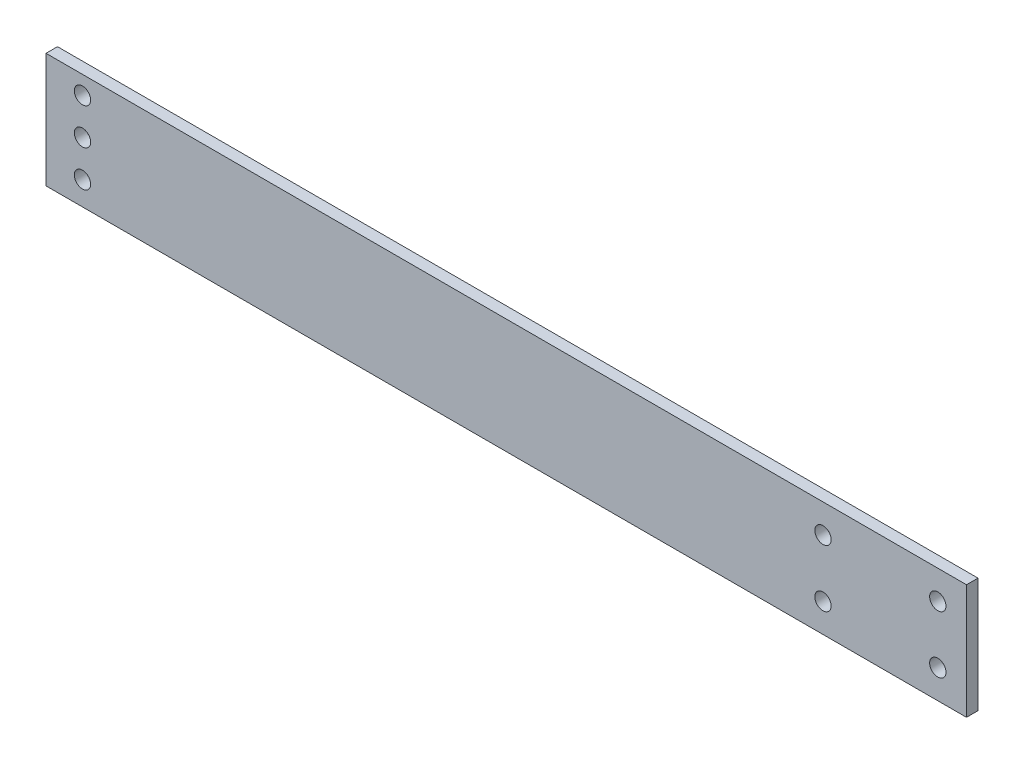
from build123d import *

# Parameters (mm, degrees)
SKETCH1_W           = 160.31
SKETCH1_H           = 20
BOSS_EXTRUDE1_DEPTH = 2
CUT_EXTRUDE1_REACH  = 82.801
SKETCH2_R           = 1.4224


with BuildPart() as part:
    # Sketch1 → Boss-Extrude1 (new body)
    with BuildSketch(Plane.XY):
        Rectangle(SKETCH1_W, SKETCH1_H)
    extrude(amount=BOSS_EXTRUDE1_DEPTH)

    # Sketch2 → Cut-Extrude1 (cut, up to next)
    with BuildSketch(Plane.XY.offset(2), mode=Mode.PRIVATE) as cut_extrude1_sk1:
        with Locations((-73.805, 6.825)):
            Circle(SKETCH2_R)
    cut_extrude1_tool1 = extrude(cut_extrude1_sk1.sketch, amount=-CUT_EXTRUDE1_REACH, mode=Mode.PRIVATE) & part.part
    # Sketch2 → Cut-Extrude1 (cut, up to next)
    with BuildSketch(Plane.XY.offset(2), mode=Mode.PRIVATE) as cut_extrude1_sk2:
        with Locations((-73.805, 0.475)):
            Circle(SKETCH2_R)
    cut_extrude1_tool2 = extrude(cut_extrude1_sk2.sketch, amount=-CUT_EXTRUDE1_REACH, mode=Mode.PRIVATE) & part.part
    # Sketch2 → Cut-Extrude1 (cut, up to next)
    with BuildSketch(Plane.XY.offset(2), mode=Mode.PRIVATE) as cut_extrude1_sk3:
        with Locations((-73.805, -5.875)):
            Circle(SKETCH2_R)
    cut_extrude1_tool3 = extrude(cut_extrude1_sk3.sketch, amount=-CUT_EXTRUDE1_REACH, mode=Mode.PRIVATE) & part.part
    # Sketch2 → Cut-Extrude1 (cut, up to next)
    with BuildSketch(Plane.XY.offset(2), mode=Mode.PRIVATE) as cut_extrude1_sk4:
        with Locations((75.155, 5)):
            Circle(SKETCH2_R)
    cut_extrude1_tool4 = extrude(cut_extrude1_sk4.sketch, amount=-CUT_EXTRUDE1_REACH, mode=Mode.PRIVATE) & part.part
    # Sketch2 → Cut-Extrude1 (cut, up to next)
    with BuildSketch(Plane.XY.offset(2), mode=Mode.PRIVATE) as cut_extrude1_sk5:
        with Locations((55.155, 5)):
            Circle(SKETCH2_R)
    cut_extrude1_tool5 = extrude(cut_extrude1_sk5.sketch, amount=-CUT_EXTRUDE1_REACH, mode=Mode.PRIVATE) & part.part
    # Sketch2 → Cut-Extrude1 (cut, up to next)
    with BuildSketch(Plane.XY.offset(2), mode=Mode.PRIVATE) as cut_extrude1_sk6:
        with Locations((55.155, -5)):
            Circle(SKETCH2_R)
    cut_extrude1_tool6 = extrude(cut_extrude1_sk6.sketch, amount=-CUT_EXTRUDE1_REACH, mode=Mode.PRIVATE) & part.part
    # Sketch2 → Cut-Extrude1 (cut, up to next)
    with BuildSketch(Plane.XY.offset(2), mode=Mode.PRIVATE) as cut_extrude1_sk7:
        with Locations((75.155, -5)):
            Circle(SKETCH2_R)
    cut_extrude1_tool7 = extrude(cut_extrude1_sk7.sketch, amount=-CUT_EXTRUDE1_REACH, mode=Mode.PRIVATE) & part.part
    add(cut_extrude1_tool1.solids().sort_by_distance((-73.805, 6.825, 2))[0], mode=Mode.SUBTRACT)
    add(cut_extrude1_tool2.solids().sort_by_distance((-73.805, 0.475, 2))[0], mode=Mode.SUBTRACT)
    add(cut_extrude1_tool3.solids().sort_by_distance((-73.805, -5.875, 2))[0], mode=Mode.SUBTRACT)
    add(cut_extrude1_tool4.solids().sort_by_distance((75.155, 5, 2))[0], mode=Mode.SUBTRACT)
    add(cut_extrude1_tool5.solids().sort_by_distance((55.155, 5, 2))[0], mode=Mode.SUBTRACT)
    add(cut_extrude1_tool6.solids().sort_by_distance((55.155, -5, 2))[0], mode=Mode.SUBTRACT)
    add(cut_extrude1_tool7.solids().sort_by_distance((75.155, -5, 2))[0], mode=Mode.SUBTRACT)


solid = part.part
